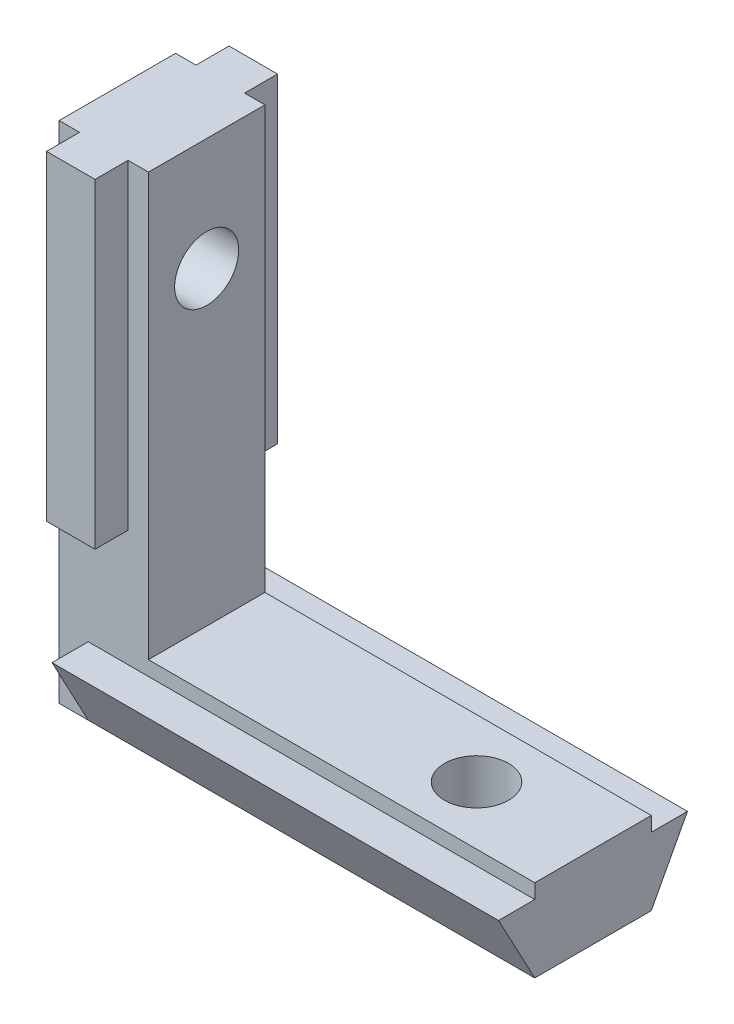
from build123d import *

# Parameters (mm, degrees)
BOSS_EXTRUDE1_DEPTH   = 3
BOSS_EXTRUDE2_DEPTH   = 24
SKETCH3_W             = 1.3
SKETCH3_H             = 10.4
BOSS_EXTRUDE3_DEPTH   = 16.5
M4X0_7_TAPPED_HOLE1_D = 3.3
M4X0_7_TAPPED_HOLE2_D = 3.3
SKETCH9_W             = 3
SKETCH9_H             = 3
CUT_EXTRUDE1_DEPTH    = 38.329478968
MOVE_FACE1_BY         = 0.75
MOVE_FACE2_BY         = 0.4
MOVE_FACE3_BY         = 0.75
MOVE_FACE3_2_BY       = 0.75
MOVE_FACE4_BY         = 0.45
MOVE_FACE4_2_BY       = 0.45
MOVE_FACE5_BY         = 0.5
MOVE_FACE5_2_BY       = 0.5
MOVE_FACE6_BY         = 1
MOVE_FACE8_BY         = 0.25
MOVE_FACE8_2_BY       = 0.25


with BuildPart() as part:
    # Sketch1 → Boss-Extrude1 (new, symmetric)
    with BuildSketch(Plane.XY):
        with BuildLine():
            Line((0, 26), (0, 0))
            Line((0, 0), (25.5, 0))
            Line((25.5, 0), (25.5, 5))
            Line((25.5, 5), (8, 5))
            ThreePointArc((8, 5), (5.878679656, 5.878679656), (5, 8))
            Line((5, 8), (5, 26))
            Line((5, 26), (0, 26))
        make_face()
    extrude(amount=BOSS_EXTRUDE1_DEPTH, both=True)

    # Sketch2 → Boss-Extrude2 (add)
    with BuildSketch(Plane(origin=(25.5, 0, 0), x_dir=(0, 0, -1), z_dir=(1, 0, 0))):
        Polygon((-3, 0), (-5, 3.75), (5, 3.75), (3, 0), align=None)
    extrude(amount=-BOSS_EXTRUDE2_DEPTH)

    # Sketch3 → Boss-Extrude3 (add)
    with BuildSketch(Plane(origin=(0, 26, 0), x_dir=(1, 0, 0), z_dir=(0, 1, 0))):
        with Locations((2.15, 0)):
            Rectangle(SKETCH3_W, SKETCH3_H)
    extrude(amount=-BOSS_EXTRUDE3_DEPTH)

    # M4x0.7 Tapped Hole1 (through all)
    with Locations(Plane(origin=(0, 5, 0), x_dir=(1, 0, 0), z_dir=(0, 1, 0))):
        with Locations((18.5, 0)):
            Hole(M4X0_7_TAPPED_HOLE1_D / 2)

    # M4x0.7 Tapped Hole2 (through all)
    with Locations(Plane(origin=(5, 0, 0), x_dir=(0, 0, -1), z_dir=(1, 0, 0))):
        with Locations((0, 20.2)):
            Hole(M4X0_7_TAPPED_HOLE2_D / 2)

    # Sketch9 → Cut-Extrude1 (cut, through all)
    with BuildSketch(Plane(origin=(0, 0, -3), x_dir=(-1, 0, 0), z_dir=(0, 0, -1))):
        with Locations((-6.5, 6.5)):
            Rectangle(SKETCH9_W, SKETCH9_H)
    extrude(amount=-CUT_EXTRUDE1_DEPTH, mode=Mode.SUBTRACT)

    # Move Face1: a face moved inward by 0.75
    extrude(part.faces().sort_by_distance((15.007117259, 5, 0))[0], amount=MOVE_FACE1_BY, dir=(0, -1, 0), mode=Mode.SUBTRACT)

    # Move Face2: a face moved inward by 0.4
    extrude(part.faces().sort_by_distance((5, 14.769055213, 0))[0], amount=MOVE_FACE2_BY, dir=(-1, 0, 0), mode=Mode.SUBTRACT)

    # Move Face3: a face moved outward by 0.75
    extrude(part.faces().sort_by_distance((2.8, 17.75, 4.1))[0], amount=MOVE_FACE3_BY, dir=(1, 0, 0))

    # Move Face3 2: a face moved outward by 0.75
    extrude(part.faces().sort_by_distance((2.8, 17.75, -4.1))[0], amount=MOVE_FACE3_2_BY, dir=(1, 0, 0))

    # Move Face4: a face moved outward by 0.45
    extrude(part.faces().sort_by_distance((1.5, 17.75, 4.1))[0], amount=MOVE_FACE4_BY, dir=(-1, 0, 0))

    # Move Face4 2: a face moved outward by 0.45
    extrude(part.faces().sort_by_distance((1.5, 17.75, -4.1))[0], amount=MOVE_FACE4_2_BY, dir=(-1, 0, 0))

    # Move Face5: a face moved inward by 0.5
    extrude(part.faces().sort_by_distance((2.3, 17.75, 5.2))[0], amount=MOVE_FACE5_BY, dir=(0, 0, -1), mode=Mode.SUBTRACT)

    # Move Face5 2: a face moved inward by 0.5
    extrude(part.faces().sort_by_distance((2.3, 17.75, -5.2))[0], amount=MOVE_FACE5_2_BY, dir=(0, 0, 1), mode=Mode.SUBTRACT)

    # Move Face6: a face moved inward by 1.0
    extrude(part.faces().sort_by_distance((25.5, 2.210227273, 0))[0], amount=MOVE_FACE6_BY, dir=(-1, 0, 0), mode=Mode.SUBTRACT)

    # Move Face8: a face moved inward by 0.25
    extrude(part.faces().sort_by_distance((13, 3.75, -4))[0], amount=MOVE_FACE8_BY, dir=(0, -1, 0), mode=Mode.SUBTRACT)

    # Move Face8 2: a face moved inward by 0.25
    extrude(part.faces().sort_by_distance((13, 3.75, 4))[0], amount=MOVE_FACE8_2_BY, dir=(0, -1, 0), mode=Mode.SUBTRACT)


solid = part.part
